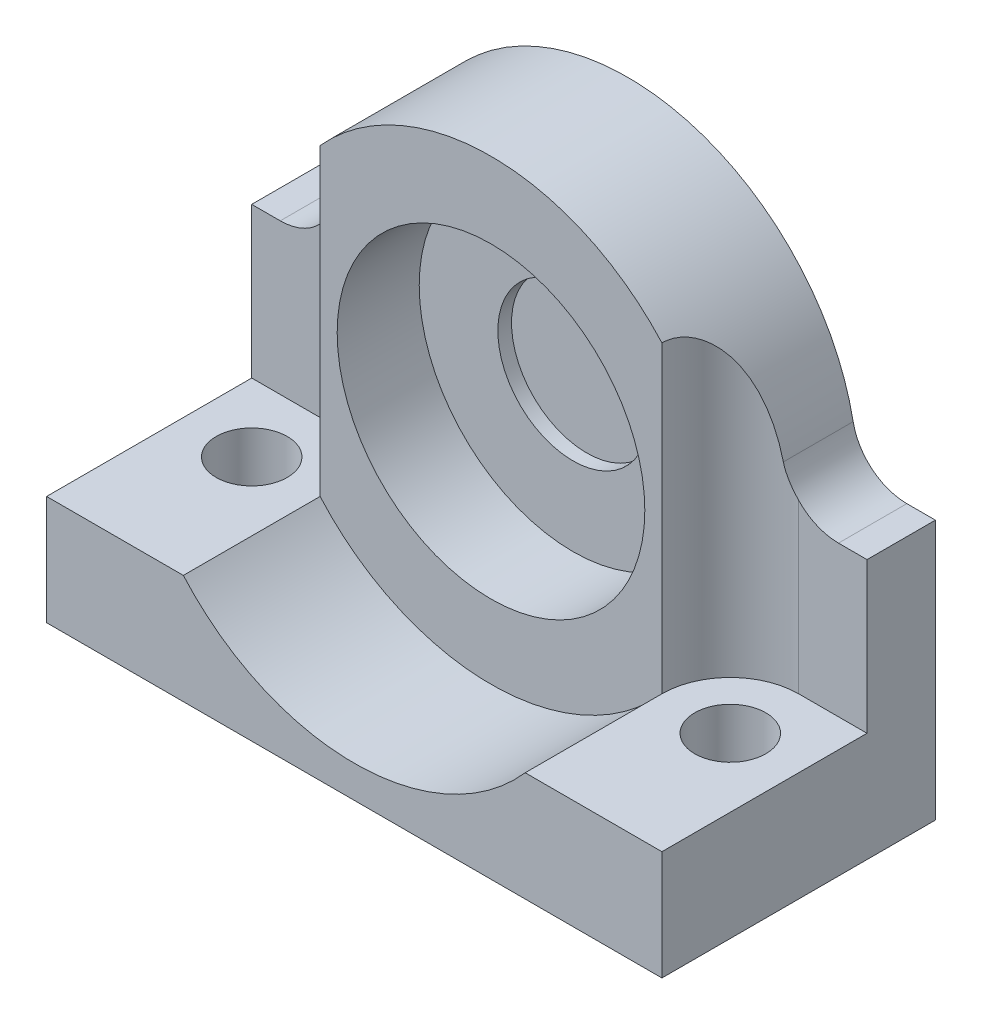
from build123d import *

# Parameters (mm, degrees)
BOSS_EXTRUDE1_DEPTH = 20
SKETCH2_W           = 10
SKETCH2_H           = 27.8
CUT_EXTRUDE1_DEPTH  = 61.882181301
SKETCH4_R           = 11.25
CUT_EXTRUDE3_DEPTH  = 6
SKETCH5_R           = 5.5
CUT_EXTRUDE4_DEPTH  = 1
CUT_EXTRUDE5_DEPTH  = 41.976700697
SKETCH7_R           = 2.6
CUT_EXTRUDE6_DEPTH  = 41.976700765
CUT_EXTRUDE7_DEPTH  = 44.449856262
FILLET1_R           = 4


with BuildPart() as part:
    # Sketch1 → Boss-Extrude1 (new body)
    with BuildSketch(Plane.XY):
        with BuildLine():
            Line((0, 0), (22.5, 0))
            Line((22.5, 0), (22.5, 19))
            Line((22.5, 19), (16.8, 19))
            ThreePointArc((16.8, 19), (0, 35.8), (-16.8, 19))
            Line((-16.8, 19), (-22.5, 19))
            Line((-22.5, 19), (-22.5, 0))
            Line((-22.5, 0), (0, 0))
        make_face()
    extrude(amount=BOSS_EXTRUDE1_DEPTH)

    # Sketch2 → Cut-Extrude1 (cut, through all)
    with BuildSketch(Plane(origin=(22.5, 0, 0), x_dir=(0, 0, -1), z_dir=(1, 0, 0))):
        with Locations((-15, 21.9)):
            Rectangle(SKETCH2_W, SKETCH2_H)
    extrude(amount=-CUT_EXTRUDE1_DEPTH, mode=Mode.SUBTRACT)

    # Sketch4 → Cut-Extrude3 (cut)
    with BuildSketch(Plane.XY.offset(10)):
        with Locations((0, 19)):
            Circle(SKETCH4_R)
    extrude(amount=-CUT_EXTRUDE3_DEPTH, mode=Mode.SUBTRACT)

    # Sketch5 → Cut-Extrude4 (cut)
    with BuildSketch(Plane.XY.offset(4)):
        with Locations((0, 19)):
            Circle(SKETCH5_R)
    extrude(amount=-CUT_EXTRUDE4_DEPTH, mode=Mode.SUBTRACT)

    # Sketch6 → Cut-Extrude5 (cut, through all)
    with BuildSketch(Plane(origin=(0, 8, 0), x_dir=(1, 0, 0), z_dir=(0, 1, 0))):
        with BuildLine():
            Line((-17.5, -5), (-22.5, -5))
            Line((-22.5, -5), (-22.5, -10))
            Line((-22.5, -10), (-12.5, -10))
            ThreePointArc((-12.5, -10), (-13.964466094, -6.464466094), (-17.5, -5))
        make_face()
        with BuildLine():
            Line((17.5, -5), (22.5, -5))
            Line((22.5, -5), (22.5, -10))
            Line((22.5, -10), (12.5, -10))
            ThreePointArc((12.5, -10), (13.964466094, -6.464466094), (17.5, -5))
        make_face()
    extrude(amount=CUT_EXTRUDE5_DEPTH, mode=Mode.SUBTRACT)

    # Sketch7 → Cut-Extrude6 (cut, through all)
    with BuildSketch(Plane(origin=(0, 8, 0), x_dir=(1, 0, 0), z_dir=(0, 1, 0))):
        with Locations(Location((-17.5, -10, 0), (0, 0, 270))):
            Circle(SKETCH7_R)
        with Locations(Location((17.5, -10, 0), (0, 0, 270))):
            Circle(SKETCH7_R)
    extrude(amount=-CUT_EXTRUDE6_DEPTH, mode=Mode.SUBTRACT)

    # Sketch8 → Cut-Extrude7 (cut, through all)
    with BuildSketch(Plane.XY.offset(10)):
        with BuildLine():
            Line((-12.5, 8), (12.5, 8))
            ThreePointArc((12.5, 8), (0, 2.349174195), (-12.5, 8))
        make_face()
    extrude(amount=CUT_EXTRUDE7_DEPTH, mode=Mode.SUBTRACT)

    # Fillet1
    fillet1_edges = [part.edges().sort_by_distance(p)[0] for p in [
        (16.8, 19, 2.524621241),
        (-16.8, 19, 2.524621241),
    ]]
    fillet(fillet1_edges, radius=FILLET1_R)


solid = part.part
